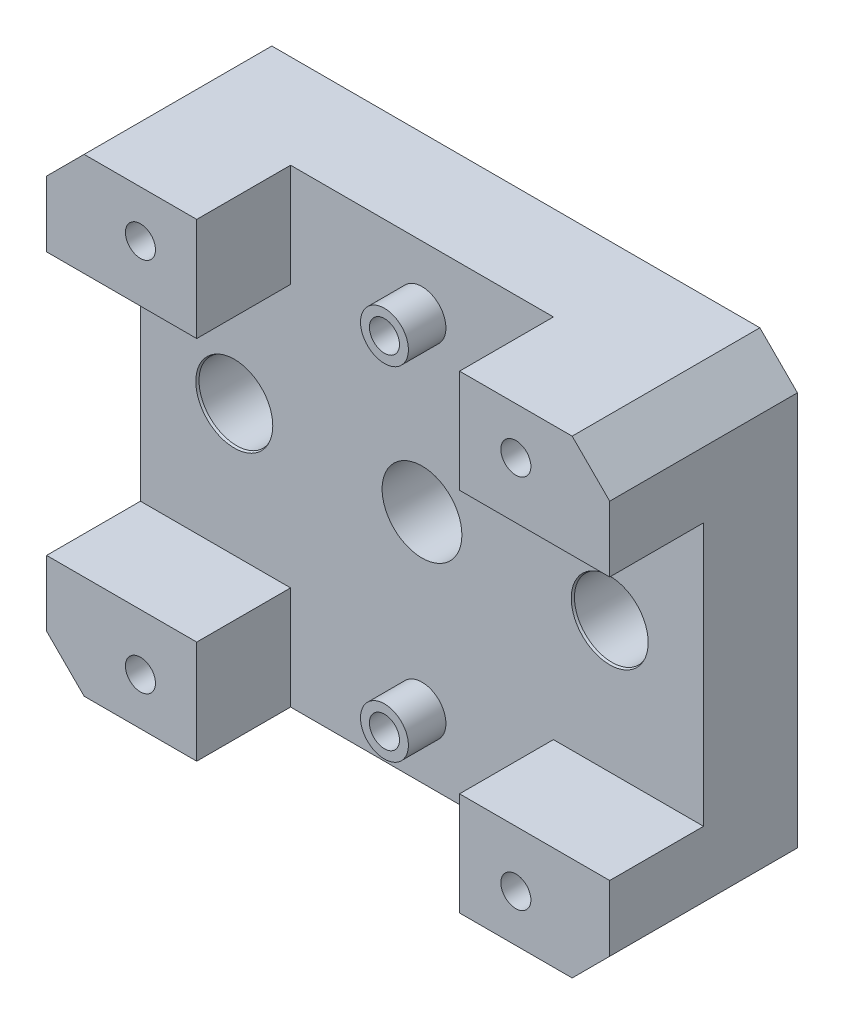
from build123d import *
from build123d.topology import SkipClean

# Parameters (mm, degrees)
SKETCH_1_W                = 60
SKETCH_1_H                = 50
EXTRUDE_1_DEPTH           = 10
HOLE_WIZARD_1_D           = 8.5
HOLE_WIZARD_1_DEPTH       = 20
HOLE_WIZARD_2_D           = 8
HOLE_WIZARD_2_CSINK_D     = 8.2
HOLE_WIZARD_2_CSINK_ANGLE = 45
SKETCH_9_R                = 2.55
EXTRUDE_3_DEPTH           = 4
HOLE_WIZARD_3_D           = 3.2
SKETCH_15_W               = 15.99731238
SKETCH_15_H               = 10.99731238
SKETCH_15_R               = 1.6
EXTRUDE_4_DEPTH           = 10
HOLE_WIZARD_4_D           = 3.2
CHAMFER_1_SIZE            = 4


with BuildPart() as part:
    # 草图1 → 凸台-拉伸1 (new body)
    with BuildSketch(Plane.XY):
        Rectangle(SKETCH_1_W, SKETCH_1_H)
    extrude(amount=EXTRUDE_1_DEPTH)

    # 孔1
    with Locations(Plane.XY.offset(10)):
        with Locations((0, 0)):
            Hole(HOLE_WIZARD_1_D / 2, depth=HOLE_WIZARD_1_DEPTH)

    # 孔2 (through all)
    with Locations(Plane.XY.offset(10)):
        with Locations((20, 0), (-20, 0)):
            CounterSinkHole(HOLE_WIZARD_2_D / 2, HOLE_WIZARD_2_CSINK_D / 2, counter_sink_angle=HOLE_WIZARD_2_CSINK_ANGLE)

    # 草图9 → 凸台-拉伸3 (add)
    with BuildSketch(Plane.XY.offset(10)):
        with Locations(Location((0, 18.25, 0), (0, 0, 180))):
            Circle(SKETCH_9_R)
        with Locations(Location((0, -18.25, 0), (0, 0, 180))):
            Circle(SKETCH_9_R)
    extrude(amount=EXTRUDE_3_DEPTH)

    # 孔3 (through all)
    with Locations(Plane.XY.offset(14)):
        with Locations((0, 18.25), (0, -18.25)):
            Hole(HOLE_WIZARD_3_D / 2)

    # 草图15 → 凸台-拉伸4 (add)
    # profile 1 of 5: a face of its own
    with BuildSketch(Plane.XY.offset(10)):
        with BuildLine():
            Line((-30, 25), (-30, 14.00268762))
            Line((-30, 14.00268762), (-14.00268762, 14.00268762))
            Line((-14.00268762, 14.00268762), (-18.86862915, 18.86862915))
            ThreePointArc((-18.86862915, 18.86862915), (-21.13137085, 18.86862915), (-21.13137085, 21.13137085))
            Line((-21.13137085, 21.13137085), (-25, 25))
            Line((-25, 25), (-30, 25))
        make_face()
    # profile 2 of 5: a face of its own
    with BuildSketch(Plane.XY.offset(10)):
        with BuildLine():
            Line((-18.86862915, 18.86862915), (-14.00268762, 14.00268762))
            Line((-14.00268762, 14.00268762), (-14.00268762, 25))
            Line((-14.00268762, 25), (-25, 25))
            Line((-25, 25), (-21.13137085, 21.13137085))
            ThreePointArc((-21.13137085, 21.13137085), (-19.387706508, 21.478207252), (-18.4, 20))
            ThreePointArc((-18.4, 20), (-18.521792748, 19.387706508), (-18.86862915, 18.86862915))
        make_face()
    # profile 3 of 5: a face of its own
    with BuildSketch(Plane.XY.offset(10)):
        with Locations((22.00134381, 19.50134381)):
            Rectangle(SKETCH_15_W, SKETCH_15_H)
        with Locations(Location((20, 20, 0), (0, 0, 180))):
            Circle(SKETCH_15_R, mode=Mode.SUBTRACT)
    # profile 4 of 5: a face of its own
    with BuildSketch(Plane.XY.offset(10)):
        with Locations((22.00134381, -19.50134381)):
            Rectangle(SKETCH_15_W, SKETCH_15_H)
        with Locations((20, -20)):
            Circle(SKETCH_15_R, mode=Mode.SUBTRACT)
    # profile 5 of 5: a face of its own
    with BuildSketch(Plane.XY.offset(10)):
        with Locations((-22.00134381, -19.50134381)):
            Rectangle(SKETCH_15_W, SKETCH_15_H)
        with Locations(Location((-20, -20, 0), (0, 0, 180))):
            Circle(SKETCH_15_R, mode=Mode.SUBTRACT)
    extrude(amount=EXTRUDE_4_DEPTH)

    # 孔4 (through all)
    with Locations(Plane.XY.offset(10)):
        with Locations((-20, 20), (20, 20), (20, -20), (-20, -20)):
            Hole(HOLE_WIZARD_4_D / 2)

    # 倒角1
    chamfer_1_edges = [part.edges().sort_by_distance(p)[0] for p in [
        (30, -25, 10),
        (-30, -25, 10),
        (-30, 25, 10),
        (30, 25, 10),
    ]]
    chamfer(chamfer_1_edges, length=CHAMFER_1_SIZE)


solid = part.part
